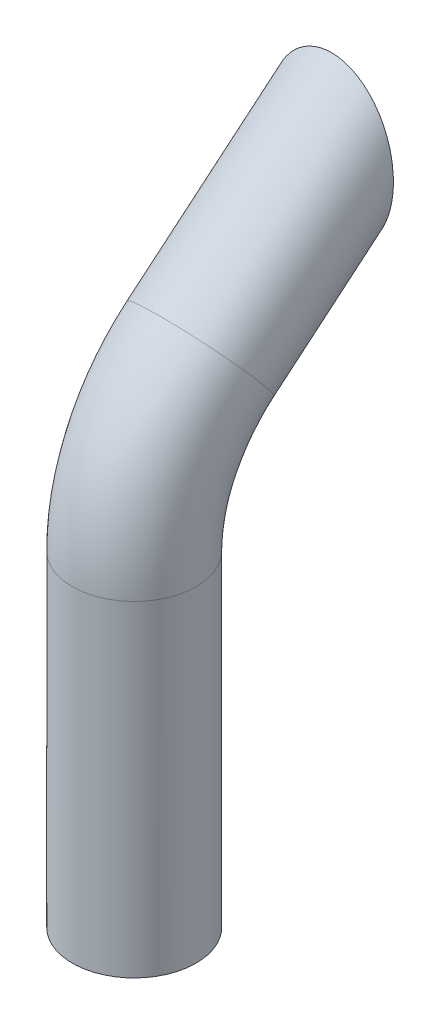
from build123d import *

# Parameters (mm, degrees)
SKETCH2_R          = 30
SKETCH2_R_2        = 27
SKETCH4_W          = 77.134513163
SKETCH4_H          = 91.925333175
CUT_EXTRUDE1_DEPTH = 45


with BuildPart() as part:
    # Sweep-Thin1: sweep along a path in Sketch1
    with BuildLine(Plane(origin=(0, 0, 0), x_dir=(0, 0, -1), z_dir=(1, 0, 0))) as sweep_thin1_path:
        Line((0, 0), (-82.75755134, -69.441830806))
        ThreePointArc((-82.75755134, -69.441830806), (-106.474367301, -100.35018713), (-114.906666468, -138.385830687))
        Line((-114.906666468, -138.385830687), (-114.906666468, -296.418141453))
    # Sketch2 → Sweep-Thin1 (sweep)
    with BuildSketch(Plane(origin=(0, 0, 0), x_dir=(1, 0, 0), z_dir=(0, -0.642787609686538, 0.7660444431189792))):
        Circle(SKETCH2_R)
        Circle(SKETCH2_R_2, mode=Mode.SUBTRACT)
    sweep(path=sweep_thin1_path.line)

    # Sketch4 → Cut-Extrude1 (cut, symmetric)
    with BuildSketch(Plane(origin=(0, 0, 0), x_dir=(0, 0, -1), z_dir=(1, 0, 0))):
        with Locations((19.28362829, -22.981333294)):
            Rectangle(SKETCH4_W, SKETCH4_H)
    extrude(amount=CUT_EXTRUDE1_DEPTH, both=True, mode=Mode.SUBTRACT)


solid = part.part
